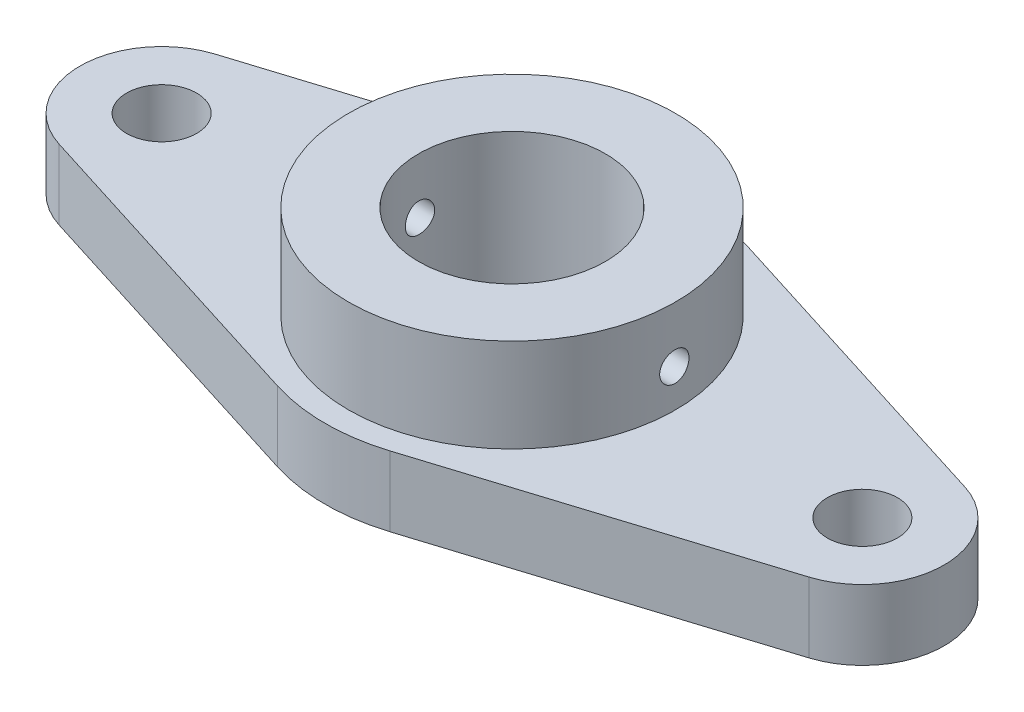
from build123d import *

# Parameters (mm, degrees)
SKETCH_1_R           = 1.5
SKETCH_1_R_2         = 7
EXTRUDE_1_DEPTH      = 3
SKETCH_1_3_R         = 7
SKETCH_1_3_R_2       = 4
EXTRUDE_2_DEPTH      = 7
HOLE_WIZARD_M1_6_1_D = 1.25


with BuildPart() as part:
    # 草图1 → 凸台-拉伸1 (new body)
    with BuildSketch(Plane(origin=(0, 0, 0), x_dir=(1, 0, 0), z_dir=(0, 1, 0))):
        with BuildLine():
            Line((-2.4, 7.631513611), (-16.05, 3.338787205))
            ThreePointArc((-16.05, 3.338787205), (-18.5, 0), (-16.05, -3.338787205))
            Line((-16.05, -3.338787205), (-2.4, -7.631513611))
            ThreePointArc((-2.4, -7.631513611), (0, -8), (2.4, -7.631513611))
            Line((2.4, -7.631513611), (16.05, -3.338787205))
            ThreePointArc((16.05, -3.338787205), (18.5, 0), (16.05, 3.338787205))
            Line((16.05, 3.338787205), (2.4, 7.631513611))
            ThreePointArc((2.4, 7.631513611), (0, 8), (-2.4, 7.631513611))
        make_face()
        with Locations((-15, 0)):
            Circle(SKETCH_1_R, mode=Mode.SUBTRACT)
        Circle(SKETCH_1_R_2, mode=Mode.SUBTRACT)
        with Locations((15, 0)):
            Circle(SKETCH_1_R, mode=Mode.SUBTRACT)
    extrude(amount=EXTRUDE_1_DEPTH)

    # 草图1<3> → 凸台-拉伸2 (add)
    with BuildSketch(Plane(origin=(0, 0, 0), x_dir=(1, 0, 0), z_dir=(0, 1, 0))):
        Circle(SKETCH_1_3_R)
        Circle(SKETCH_1_3_R_2, mode=Mode.SUBTRACT)
    extrude(amount=EXTRUDE_2_DEPTH)

    # M1.6 螺纹孔1 (through all)
    with Locations(Plane(origin=(6.99996172, 4.619290958, 0.023149905), x_dir=(-0.003307129319, 0, 0.999994531433), z_dir=(0.999994531433, 0, 0.003307129319))):
        with Locations((0, 0)):
            Hole(HOLE_WIZARD_M1_6_1_D / 2)


solid = part.part
